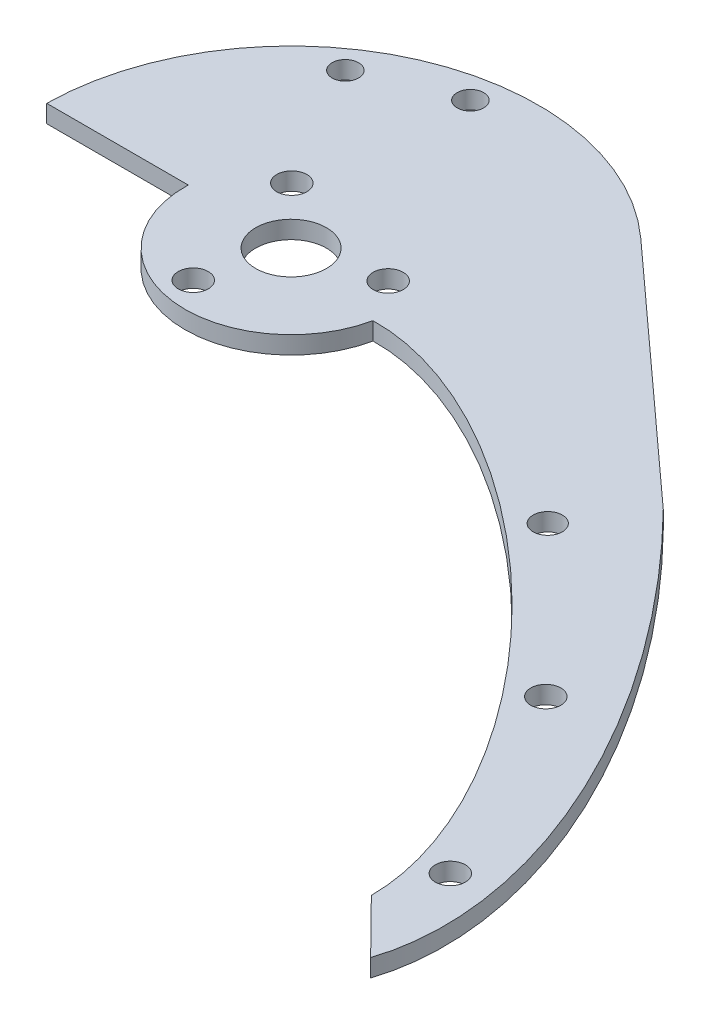
from build123d import *

# Parameters (mm, degrees)
SKETCH_1_R          = 1.7
SKETCH_1_R_2        = 4
EXTRUDE_1_DEPTH     = 2
SKETCH_2_R          = 1.5
SKETCH_2_R_2        = 1.7
SKETCH_2_R_3        = 1.65
CUT_EXTRUDE_2_DEPTH = 100.30986231


with BuildPart() as part:
    # Эскиз1 → Бобышка-Вытянуть1 (new body)
    with BuildSketch(Plane(origin=(0, 0, 0), x_dir=(1, 0, 0), z_dir=(0, 1, 0))):
        with BuildLine():
            Line((-11.994516295, 0.362737998), (-27.997650279, 0.362737998))
            ThreePointArc((-27.997650279, 0.362737998), (-19.670324553, 19.926824433), (0, 28))
            ThreePointArc((0, 28), (10.092907112, 26.117680334), (18.828808684, 20.72380186))
            Line((18.828808684, 20.72380186), (46.640586318, -4.544855106))
            add(Edge.make_bspline(
                [(73.991805315, -64.992405718), (82.088977067, -40.455490793), (46.640586318, -4.544855106)],
                knots=[0.235504237, 0.235504237, 0.235504237, 1.570796327, 1.570796327, 1.570796327], degree=2, weights=[1, 0.785281266, 1]))
            Line((73.991805315, -64.992405718), (67.937451343, -58.859103325))
            add(Edge.make_bspline(
                [(67.937451343, -58.859103325), (68.070075227, -1.227091326), (11.741792344, -2.475946799)],
                knots=[3.541017893, 3.541017893, 3.541017893, 5.906750707, 5.906750707, 5.906750707], degree=2, weights=[1, 0.378272966, 1]))
            ThreePointArc((11.741792344, -2.475946799), (-1.424956207, -11.915095459), (-11.994516295, 0.362737998))
        make_face()
        with Locations(Location((-6.322604321, 6.40505071, 0), (0, 0, 270))):
            Circle(SKETCH_1_R, mode=Mode.SUBTRACT)
        with Locations(Location((0, 0, 0), (0, 0, 270))):
            Circle(SKETCH_1_R_2, mode=Mode.SUBTRACT)
        with Locations(Location((8.708238788, 2.273010605, 0), (0, 0, 270))):
            Circle(SKETCH_1_R, mode=Mode.SUBTRACT)
        with Locations(Location((-2.385634467, -8.678061315, 0), (0, 0, 270))):
            Circle(SKETCH_1_R, mode=Mode.SUBTRACT)
    extrude(amount=EXTRUDE_1_DEPTH)

    # Эскиз2 → Вырез-Вытянуть2 (cut, through all)
    with BuildSketch(Plane(origin=(0, 2, 0), x_dir=(1, 0, 0), z_dir=(0, 1, 0))):
        with Locations(Location((-4.341204442, 24.620193825, 0), (0, 0, 270))):
            Circle(SKETCH_2_R)
        with Locations(Location((-14.339410909, 20.478801107, 0), (0, 0, 90))):
            Circle(SKETCH_2_R)
        with Locations(Location((58.334133011, -29.525755439, 0), (0, 0, 270))):
            Circle(SKETCH_2_R_2)
        with Locations(Location((70.257880668, -52.24397848, 0), (0, 0, 270))):
            Circle(SKETCH_2_R_2)
        with Locations(Location((41.483595962, -12.455488374, 0), (0, 0, 270))):
            Circle(SKETCH_2_R_3)
    extrude(amount=-CUT_EXTRUDE_2_DEPTH, mode=Mode.SUBTRACT)


solid = part.part
